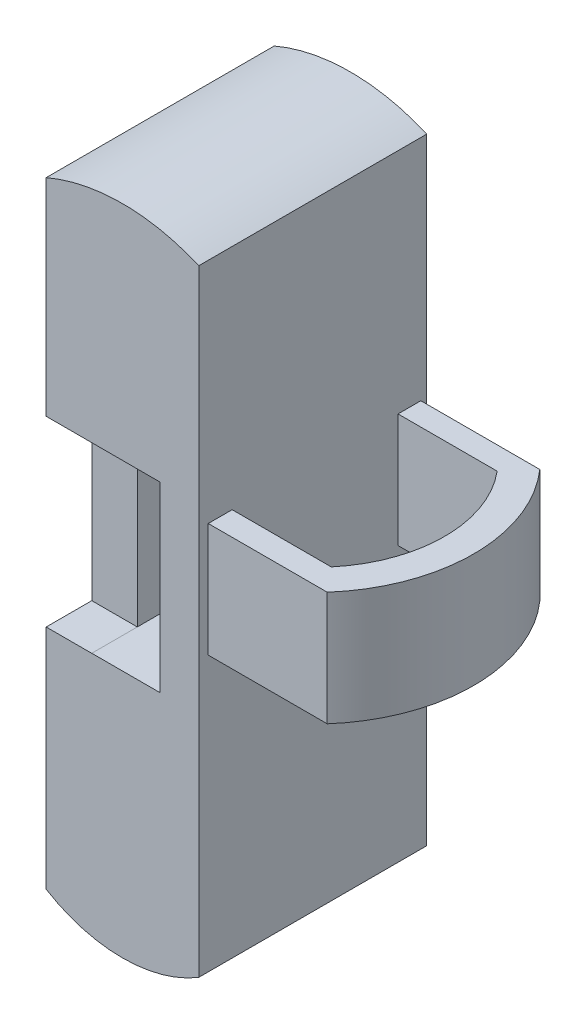
from build123d import *

# Parameters (mm, degrees)
EXTRUDE_1_DEPTH     = 10
SKETCH_3_W          = 3
SKETCH_3_H          = 8
CUT_EXTRUDE_2_DEPTH = 10
EXTRUDE_2_DEPTH     = 2.5
CUT_EXTRUDE_3_DEPTH = 5
SKETCH_7_W          = 2
SKETCH_7_H          = 8.000466976
CUT_EXTRUDE_4_DEPTH = 2
SKETCH_8_W          = 2
SKETCH_8_H          = 8.002206322
CUT_EXTRUDE_5_DEPTH = 2


with BuildPart() as part:
    # 草圖1 → 填料-伸長1 (new body)
    with BuildSketch(Plane.XY):
        with BuildLine():
            Line((0, 0), (0, -27.033455112))
            ThreePointArc((0, -27.033455112), (3.346359716, -27.968396912), (6.692719433, -27.033455112))
            Line((6.692719433, -27.033455112), (6.692719433, 0))
            ThreePointArc((6.692719433, 0), (3.346359716, 0.689675236), (0, 0))
        make_face()
    extrude(amount=EXTRUDE_1_DEPTH)

    # 草圖3 → 除料-伸長2 (cut)
    with BuildSketch(Plane.XY.offset(10)):
        with Locations((3.5, -13.067229779)):
            Rectangle(SKETCH_3_W, SKETCH_3_H)
    extrude(amount=-CUT_EXTRUDE_2_DEPTH, mode=Mode.SUBTRACT)

    # 草圖4 → 填料-伸長2 (add, symmetric)
    with BuildSketch(Plane(origin=(0, -12.5, -0.092640319), x_dir=(1, 0, 0), z_dir=(0, 1, 0))):
        with BuildLine():
            Line((6.308695553, -9.676441633), (11.912423264, -9.676441633))
            ThreePointArc((11.912423264, -9.676441633), (13.672894686, -5.014177318), (11.912423264, -0.351913003))
            Line((11.912423264, -0.351913003), (6.308695553, -0.351913003))
            Line((6.308695553, -0.351913003), (6.308695553, -9.676441633))
        make_face()
    extrude(amount=EXTRUDE_2_DEPTH, both=True)

    # 草圖6 → 除料-伸長3 (cut)
    with BuildSketch(Plane(origin=(0, -10, 0), x_dir=(1, 0, 0), z_dir=(0, 1, 0))):
        with BuildLine():
            Line((6.692719433, -8.535251287), (11.039203193, -8.535251287))
            ThreePointArc((11.039203193, -8.535251287), (12.370150215, -4.897261986), (11.039203193, -1.259272684))
            Line((11.039203193, -1.259272684), (6.692719433, -1.259272684))
            Line((6.692719433, -1.259272684), (6.692719433, -8.535251287))
        make_face()
    extrude(amount=-CUT_EXTRUDE_3_DEPTH, mode=Mode.SUBTRACT)

    # 草圖7 → 除料-伸長4 (cut)
    with BuildSketch(Plane(origin=(0, 0, 0), x_dir=(-1, 0, 0), z_dir=(0, 0, -1))):
        with Locations((-1, -13.067463267)):
            Rectangle(SKETCH_7_W, SKETCH_7_H)
    extrude(amount=-CUT_EXTRUDE_4_DEPTH, mode=Mode.SUBTRACT)

    # 草圖8 → 除料-伸長5 (cut)
    with BuildSketch(Plane.XY.offset(10)):
        with Locations((1, -13.06833294)):
            Rectangle(SKETCH_8_W, SKETCH_8_H)
    extrude(amount=-CUT_EXTRUDE_5_DEPTH, mode=Mode.SUBTRACT)


solid = part.part
